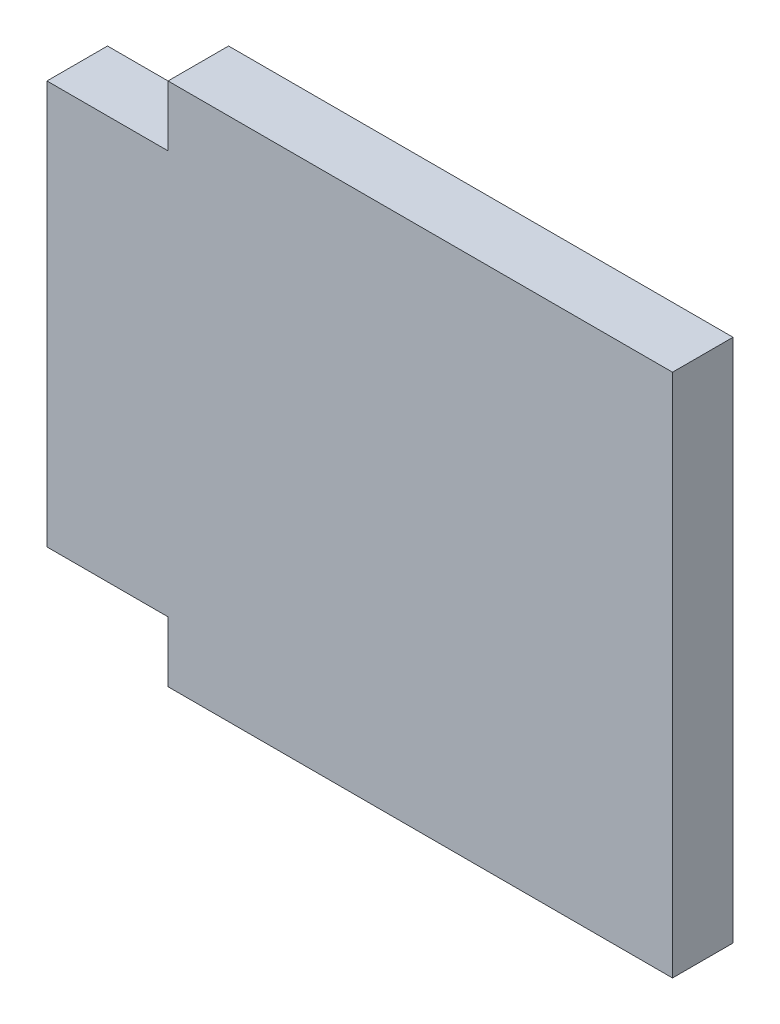
from build123d import *

# Parameters (mm, degrees)
Y_KSEKLIK_EKSTR_ZYON1_DEPTH = 3


with BuildPart() as part:
    # Çizim1 → Yükseklik-Ekstrüzyon1 (new body)
    with BuildSketch(Plane.XY):
        Polygon((0, 0), (0, 20), (6, 20), (6, 23), (31, 23), (31, -3), (6, -3), (6, 0), align=None)
    extrude(amount=Y_KSEKLIK_EKSTR_ZYON1_DEPTH)


solid = part.part
